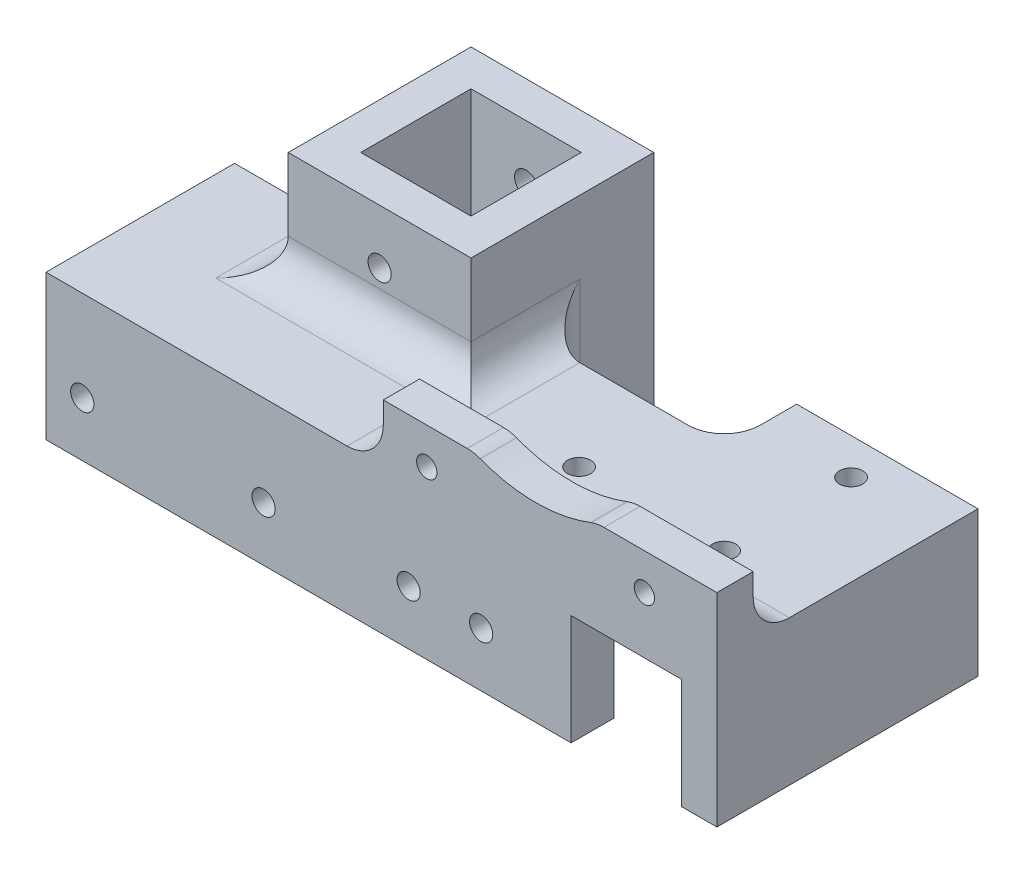
from build123d import *

# Parameters (mm, degrees)
SKETCH_1_W          = 15.2
SKETCH_1_H          = 15.2
EXTRUDE_1_DEPTH     = 20
SKETCH_2_W          = 25.2
SKETCH_2_H          = 25.2
SKETCH_2_W_2        = 15.2
SKETCH_2_H_2        = 15.2
EXTRUDE_2_DEPTH     = 15
SKETCH_3_W          = 15.2
SKETCH_3_H          = 15.2
CUT_EXTRUDE_1_DEPTH = 80
SKETCH_4_R          = 1.6
CUT_EXTRUDE_2_DEPTH = 83.635888087
FILLET_1_R          = 5
SKETCH_5_W          = 15.2
SKETCH_5_H          = 15.2
CUT_EXTRUDE_3_DEPTH = 83.635888087
CUT_EXTRUDE_5_REACH = 73.229
SKETCH_7_R          = 1.6
SKETCH_8_W          = 46
SKETCH_8_H          = 5
EXTRUDE_3_DEPTH     = 8
FILLET_2_R          = 5
CUT_EXTRUDE_6_REACH = 84.636
SKETCH_9_R          = 21.25
SKETCH_9_R_2        = 1.4
FILLET_3_R          = 5


with BuildPart() as part:
    # 草图1 → 凸台-拉伸1 (new body)
    with BuildSketch(Plane(origin=(0, 0, 0), x_dir=(1, 0, 0), z_dir=(0, 1, 0))):
        Polygon((-30, 12.5), (-12.6, 12.5), (-12.6, 27.7), (12.6, 27.7), (12.6, 12.5), (37.5, 12.5), (37.5, 22.5), (62.5, 22.5), (62.5, -13.5), (-30, -13.5), align=None)
        with Locations((0, 15.1)):
            Rectangle(SKETCH_1_W, SKETCH_1_H, mode=Mode.SUBTRACT)
    extrude(amount=EXTRUDE_1_DEPTH)

    # 草图2 → 凸台-拉伸2 (add)
    with BuildSketch(Plane(origin=(0, 20, 0), x_dir=(1, 0, 0), z_dir=(0, 1, 0))):
        with Locations((0, 15.1)):
            Rectangle(SKETCH_2_W, SKETCH_2_H)
        with Locations((0, 15.1)):
            Rectangle(SKETCH_2_W_2, SKETCH_2_H_2, mode=Mode.SUBTRACT)
    extrude(amount=EXTRUDE_2_DEPTH)

    # 草图3 → 切除-拉伸1 (cut)
    with BuildSketch(Plane(origin=(-30, 0, 0), x_dir=(0, 0, -1), z_dir=(1, 0, 0))):
        with Locations((0, 7.6)):
            Rectangle(SKETCH_3_W, SKETCH_3_H)
    extrude(amount=CUT_EXTRUDE_1_DEPTH, mode=Mode.SUBTRACT)

    # 草图4 → 切除-拉伸2 (cut, through all)
    with BuildSketch(Plane.XY.offset(13.5)):
        with Locations((0, 7.5)):
            Circle(SKETCH_4_R)
        with Locations((20, 7.5)):
            Circle(SKETCH_4_R)
        with Locations((-25, 7.5)):
            Circle(SKETCH_4_R)
        with Locations((0, 27.5)):
            Circle(SKETCH_4_R)
        with Locations((30, 7.5)):
            Circle(SKETCH_4_R)
    extrude(amount=-CUT_EXTRUDE_2_DEPTH, mode=Mode.SUBTRACT)

    # 圆角1
    fillet_1_edges = [part.edges().sort_by_distance(p)[0] for p in [
        (-12.6, 10, -12.5),
        (12.6, 10, -12.5),
        (37.5, 10, -12.5),
        (-12.6, 20, -7.5),
        (0, 20, -2.5),
        (12.6, 20, -7.5),
    ]]
    fillet(fillet_1_edges, radius=FILLET_1_R)

    # 草图5 → 切除-拉伸3 (cut, through all)
    with BuildSketch(Plane.XY.offset(13.5)):
        with Locations((50, 7.6)):
            Rectangle(SKETCH_5_W, SKETCH_5_H)
    extrude(amount=-CUT_EXTRUDE_3_DEPTH, mode=Mode.SUBTRACT)

    # 草图7 → 切除-拉伸5 (cut, up to next)
    with BuildSketch(Plane(origin=(0, 20, 0), x_dir=(1, 0, 0), z_dir=(0, 1, 0)), mode=Mode.PRIVATE) as cut_extrude_5_sk1:
        with Locations(Location((50, 0, 0), (0, 0, 270))):
            Circle(SKETCH_7_R)
    cut_extrude_5_tool1 = extrude(cut_extrude_5_sk1.sketch, amount=-CUT_EXTRUDE_5_REACH, mode=Mode.PRIVATE) & part.part
    # 草图7 → 切除-拉伸5 (cut, up to next)
    with BuildSketch(Plane(origin=(0, 20, 0), x_dir=(1, 0, 0), z_dir=(0, 1, 0)), mode=Mode.PRIVATE) as cut_extrude_5_sk2:
        with Locations(Location((30, 0, 0), (0, 0, 270))):
            Circle(SKETCH_7_R)
    cut_extrude_5_tool2 = extrude(cut_extrude_5_sk2.sketch, amount=-CUT_EXTRUDE_5_REACH, mode=Mode.PRIVATE) & part.part
    # 草图7 → 切除-拉伸5 (cut, up to next)
    with BuildSketch(Plane(origin=(0, 20, 0), x_dir=(1, 0, 0), z_dir=(0, 1, 0)), mode=Mode.PRIVATE) as cut_extrude_5_sk3:
        with Locations(Location((50, 17.5, 0), (0, 0, 270))):
            Circle(SKETCH_7_R)
    cut_extrude_5_tool3 = extrude(cut_extrude_5_sk3.sketch, amount=-CUT_EXTRUDE_5_REACH, mode=Mode.PRIVATE) & part.part
    add(cut_extrude_5_tool1.solids().sort_by_distance((50, 20, 0))[0], mode=Mode.SUBTRACT)
    add(cut_extrude_5_tool2.solids().sort_by_distance((30, 20, 0))[0], mode=Mode.SUBTRACT)
    add(cut_extrude_5_tool3.solids().sort_by_distance((50, 20, -17.5))[0], mode=Mode.SUBTRACT)

    # 草图8 → 凸台-拉伸3 (add)
    with BuildSketch(Plane(origin=(0, 20, 0), x_dir=(1, 0, 0), z_dir=(0, 1, 0))):
        with Locations((39.5, -11)):
            Rectangle(SKETCH_8_W, SKETCH_8_H)
    extrude(amount=EXTRUDE_3_DEPTH)

    # 圆角2
    fillet_2_edges = [part.edges().sort_by_distance(p)[0] for p in [
        (39.5, 20, 8.5),
    ]]
    fillet(fillet_2_edges, radius=FILLET_2_R)

    # 草图9 → 切除-拉伸6 (cut, up to next)
    with BuildSketch(Plane.XY.offset(13.5), mode=Mode.PRIVATE) as cut_extrude_6_sk1:
        with Locations((37.5, 47.5)):
            Circle(SKETCH_9_R)
    cut_extrude_6_tool1 = extrude(cut_extrude_6_sk1.sketch, amount=-CUT_EXTRUDE_6_REACH, mode=Mode.PRIVATE) & part.part
    # 草图9 → 切除-拉伸6 (cut, up to next)
    with BuildSketch(Plane.XY.offset(13.5), mode=Mode.PRIVATE) as cut_extrude_6_sk2:
        with Locations((22.5, 23)):
            Circle(SKETCH_9_R_2)
    cut_extrude_6_tool2 = extrude(cut_extrude_6_sk2.sketch, amount=-CUT_EXTRUDE_6_REACH, mode=Mode.PRIVATE) & part.part
    # 草图9 → 切除-拉伸6 (cut, up to next)
    with BuildSketch(Plane.XY.offset(13.5), mode=Mode.PRIVATE) as cut_extrude_6_sk3:
        with Locations((52.5, 23)):
            Circle(SKETCH_9_R_2)
    cut_extrude_6_tool3 = extrude(cut_extrude_6_sk3.sketch, amount=-CUT_EXTRUDE_6_REACH, mode=Mode.PRIVATE) & part.part
    add(cut_extrude_6_tool1.solids().sort_by_distance((37.5, 47.5, 13.5))[0], mode=Mode.SUBTRACT)
    add(cut_extrude_6_tool2.solids().sort_by_distance((22.5, 23, 13.5))[0], mode=Mode.SUBTRACT)
    add(cut_extrude_6_tool3.solids().sort_by_distance((52.5, 23, 13.5))[0], mode=Mode.SUBTRACT)

    # 圆角3
    fillet_3_edges = [part.edges().sort_by_distance(p)[0] for p in [
        (16.5, 20, 8.5),
        (45.944672877, 28, 11),
        (29.055327123, 28, 11),
    ]]
    fillet(fillet_3_edges, radius=FILLET_3_R)


solid = part.part
